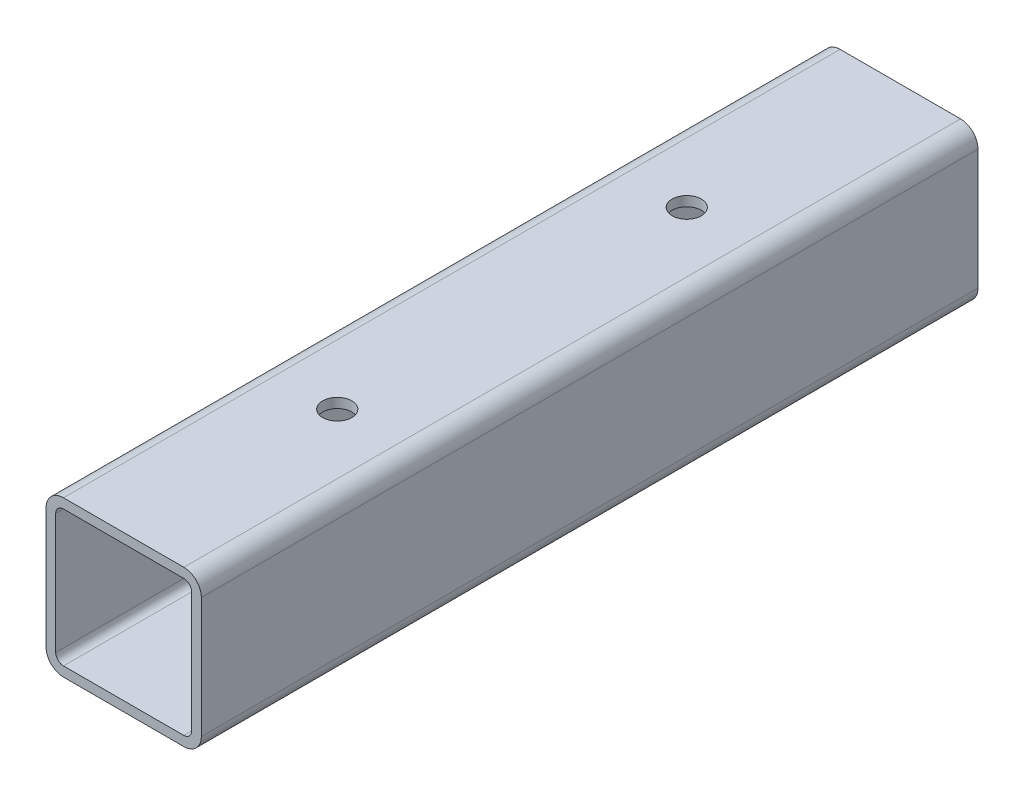
from build123d import *

# Parameters (mm, degrees)
BOSS_EXTRUDE1_DEPTH = 127
SKETCH2_R           = 4.7625
CUT_EXTRUDE1_DEPTH  = 38.1


with BuildPart() as part:
    # Sketch1 → Boss-Extrude1 (new, symmetric)
    with BuildSketch(Plane.XY):
        with BuildLine():
            Line((-19.685, 25.4), (19.685, 25.4))
            ThreePointArc((19.685, 25.4), (23.726115254, 23.726115254), (25.4, 19.685))
            Line((25.4, 19.685), (25.4, -19.685))
            ThreePointArc((25.4, -19.685), (23.726115254, -23.726115254), (19.685, -25.4))
            Line((19.685, -25.4), (-19.685, -25.4))
            ThreePointArc((-19.685, -25.4), (-23.726115254, -23.726115254), (-25.4, -19.685))
            Line((-25.4, -19.685), (-25.4, 19.685))
            ThreePointArc((-25.4, 19.685), (-23.726115254, 23.726115254), (-19.685, 25.4))
        make_face()
        with BuildLine():
            Line((-19.685, -22.225), (19.685, -22.225))
            ThreePointArc((19.685, -22.225), (21.481051224, -21.481051224), (22.225, -19.685))
            Line((22.225, -19.685), (22.225, 19.685))
            ThreePointArc((22.225, 19.685), (21.481051224, 21.481051224), (19.685, 22.225))
            Line((19.685, 22.225), (-19.685, 22.225))
            ThreePointArc((-19.685, 22.225), (-21.481051224, 21.481051224), (-22.225, 19.685))
            Line((-22.225, 19.685), (-22.225, -19.685))
            ThreePointArc((-22.225, -19.685), (-21.481051224, -21.481051224), (-19.685, -22.225))
        make_face(mode=Mode.SUBTRACT)
    extrude(amount=BOSS_EXTRUDE1_DEPTH, both=True)

    # Sketch2 → Cut-Extrude1 (cut, symmetric)
    with BuildSketch(Plane(origin=(0, 0, 0), x_dir=(1, 0, 0), z_dir=(0, 1, 0))):
        with Locations(Location((0, 57.15, 0), (0, 0, 270))):
            Circle(SKETCH2_R)
        with Locations(Location((0, -57.15, 0), (0, 0, 270))):
            Circle(SKETCH2_R)
    extrude(amount=CUT_EXTRUDE1_DEPTH, both=True, mode=Mode.SUBTRACT)


solid = part.part
